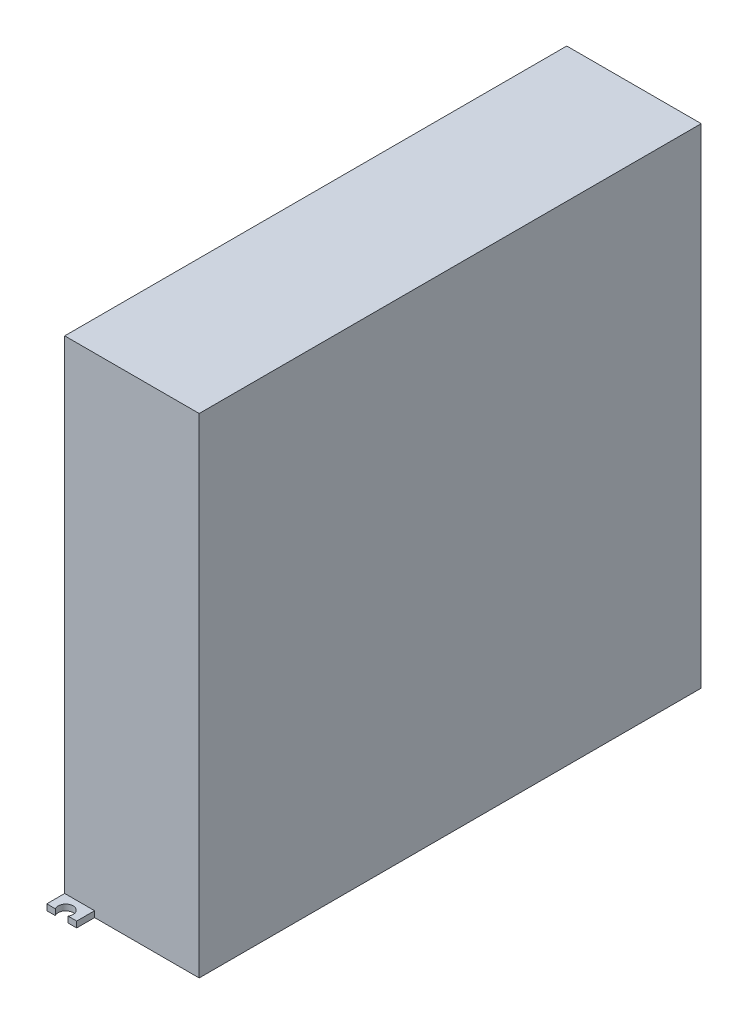
from build123d import *

# Parameters (mm, degrees)
SKETCH_1_W            = 45
SKETCH_1_H            = 168
EXTRUDE_1_DEPTH       = 163.6
SKETCH_2_W            = 10
SKETCH_2_H            = 6
EXTRUDE_2_DEPTH       = 2
F_5_0MM_1_D           = 5
F_5_0MM_1_CSINK_D     = 5.05
F_5_0MM_1_CSINK_ANGLE = 100


with BuildPart() as part:
    # 草图1 → 凸台-拉伸1 (new body)
    with BuildSketch(Plane(origin=(0, 0, 0), x_dir=(1, 0, 0), z_dir=(0, 1, 0))):
        with Locations((22.5, -84)):
            Rectangle(SKETCH_1_W, SKETCH_1_H)
    extrude(amount=EXTRUDE_1_DEPTH)

    # 草图2 → 凸台-拉伸2 (add)
    with BuildSketch(Plane.XZ):
        with Locations((5, 171)):
            Rectangle(SKETCH_2_W, SKETCH_2_H)
    extrude(amount=-EXTRUDE_2_DEPTH)

    # Ø5.0mm 暗销孔1 (through all)
    with Locations(Plane(origin=(0, 0, 0), x_dir=(-1, 0, 0), z_dir=(0, -1, 0))):
        with Locations((-5, -172.677656)):
            CounterSinkHole(F_5_0MM_1_D / 2, F_5_0MM_1_CSINK_D / 2, counter_sink_angle=F_5_0MM_1_CSINK_ANGLE)


solid = part.part
